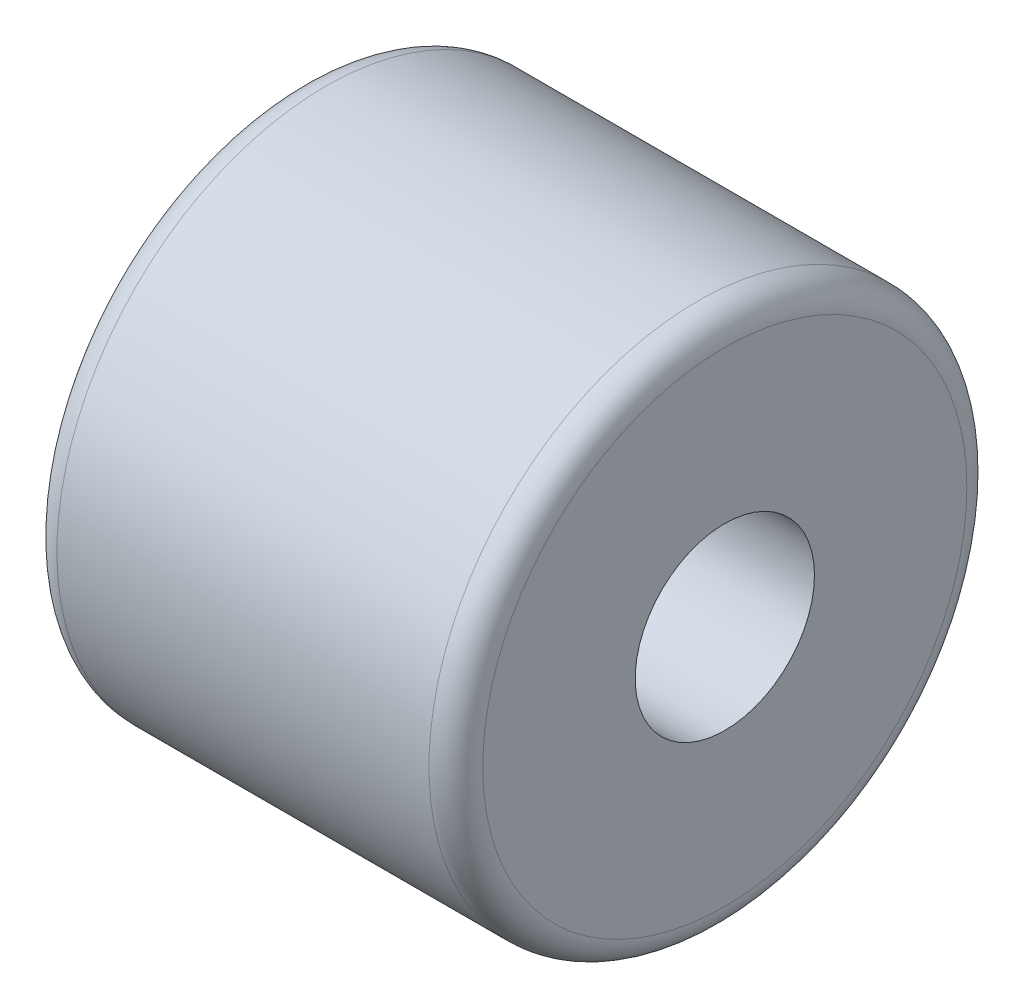
from build123d import *

# Parameters (mm, degrees)
ESQUISSE1_R        = 6
ESQUISSE1_R_2      = 2
BOSS_EXTRU_1_DEPTH = 4.75
CONG_1_R           = 0.6


with BuildPart() as part:
    # Esquisse1 → Boss.-Extru.1 (new, symmetric)
    with BuildSketch(Plane(origin=(0, 0, 0), x_dir=(0, 0, -1), z_dir=(1, 0, 0))):
        Circle(ESQUISSE1_R)
        Circle(ESQUISSE1_R_2, mode=Mode.SUBTRACT)
    extrude(amount=BOSS_EXTRU_1_DEPTH, both=True)

    # Congé1
    cong_1_edges = [part.edges().sort_by_distance(p)[0] for p in [
        (-4.75, 0, 6),
        (4.75, 0, 6),
    ]]
    fillet(cong_1_edges, radius=CONG_1_R)


solid = part.part
